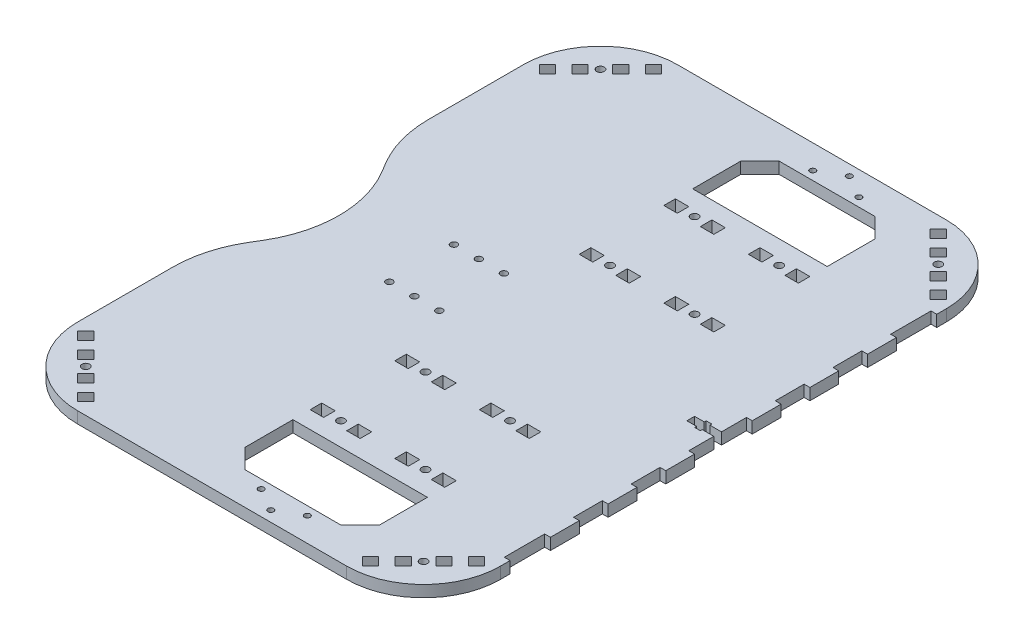
from build123d import *

# Parameters (mm, degrees)
ESQUISSE1_W                  = 220
ESQUISSE1_H                  = 312
BOSS_EXTRU_1_DEPTH           = 6
ESQUISSE2_R                  = 2
ESQUISSE2_W                  = 7
ESQUISSE2_H                  = 6
ENL_V_MAT_EXTRU_1_DEPTH      = 284.742811787
ESQUISSE3_W                  = 70
ESQUISSE3_H                  = 35
ENL_V_MAT_EXTRU_2_DEPTH      = 284.742811787
R_P_TITION_LIN_AIRE1_COUNT   = 2
R_P_TITION_LIN_AIRE1_PITCH   = 44
ESQUISSE4_R                  = 1.5
ENL_V_MAT_EXTRU_3_DEPTH      = 284.742811787
CHANFREIN1_SIZE              = 10
SYM_TRIE1_COPY_1_SKETCH_R    = 2
SYM_TRIE1_COPY_1_SKETCH_W    = 7
SYM_TRIE1_COPY_1_SKETCH_H    = 6
SYM_TRIE1_COPY_1_DEPTH       = 284.742811787
CHANFREIN1_OF_SYM_TRIE1_SIZE = 10
CONG_1_R                     = 40
ESQUISSE5_R                  = 1.75
ENL_V_MAT_EXTRU_4_DEPTH      = 284.742811787
ESQUISSE6_R                  = 2
ENL_V_MAT_EXTRU_5_DEPTH      = 6
SYM_TRIE3_COPY_1_SKETCH_R    = 2
SYM_TRIE3_COPY_1_DEPTH       = 6
ESQUISSE7_W                  = 3
ESQUISSE7_H                  = 15
ESQUISSE7_H_2                = 21
ENL_V_MAT_EXTRU_6_DEPTH      = 6
ENL_V_MAT_EXTRU_7_DEPTH      = 6
CONG_2_R                     = 60


with BuildPart() as part:
    # Esquisse1 → Boss.-Extru.1 (new body)
    with BuildSketch(Plane(origin=(0, 0, 0), x_dir=(1, 0, 0), z_dir=(0, 1, 0))):
        with Locations((39.245977219, 85.245977219)):
            Rectangle(ESQUISSE1_W, ESQUISSE1_H)
    extrude(amount=BOSS_EXTRU_1_DEPTH)

    # Esquisse2 → Enlèv. mat.-Extru.1 (cut, through all)
    with BuildSketch(Plane(origin=(0, 6, 0), x_dir=(1, 0, 0), z_dir=(0, 1, 0))):
        with Locations(Location((86.245977219, 177.245977219, 0), (0, 0, 270))):
            Circle(ESQUISSE2_R)
        with Locations(Location((42.245977219, 177.245977219, 0), (0, 0, 270))):
            Circle(ESQUISSE2_R)
        with Locations((95.745977219, 177.245977219)):
            Rectangle(ESQUISSE2_W, ESQUISSE2_H)
        with Locations((76.745977219, 177.245977219)):
            Rectangle(ESQUISSE2_W, ESQUISSE2_H)
        with Locations((51.745977219, 177.245977219)):
            Rectangle(ESQUISSE2_W, ESQUISSE2_H)
        with Locations((32.745977219, 177.245977219)):
            Rectangle(ESQUISSE2_W, ESQUISSE2_H)
    enl_v_mat_extru_1 = extrude(amount=-ENL_V_MAT_EXTRU_1_DEPTH, mode=Mode.SUBTRACT)

    # Esquisse3 → Enlèv. mat.-Extru.2 (cut, through all)
    with BuildSketch(Plane(origin=(0, 6, 0), x_dir=(1, 0, 0), z_dir=(0, 1, 0))):
        with Locations((64.245977219, 206.745977219)):
            Rectangle(ESQUISSE3_W, ESQUISSE3_H)
    enl_v_mat_extru_2 = extrude(amount=-ENL_V_MAT_EXTRU_2_DEPTH, mode=Mode.SUBTRACT)

    # Répétition linéaire1: Enlèv. mat.-Extru.1 ×2
    with Locations(*[(0, 0, i * R_P_TITION_LIN_AIRE1_PITCH) for i in range(1, R_P_TITION_LIN_AIRE1_COUNT)]):
        add(enl_v_mat_extru_1, mode=Mode.SUBTRACT)

    # Esquisse4 → Enlèv. mat.-Extru.3 (cut, through all)
    with BuildSketch(Plane(origin=(0, 6, 0), x_dir=(1, 0, 0), z_dir=(0, 1, 0))):
        with Locations(Location((52.245977219, 228.745977219, 0), (0, 0, 270))):
            Circle(ESQUISSE4_R)
        with Locations(Location((64.245977219, 235.745977219, 0), (0, 0, 270))):
            Circle(ESQUISSE4_R)
        with Locations(Location((76.245977219, 228.745977219, 0), (0, 0, 270))):
            Circle(ESQUISSE4_R)
    enl_v_mat_extru_3 = extrude(amount=-ENL_V_MAT_EXTRU_3_DEPTH, mode=Mode.SUBTRACT)

    # Chanfrein1
    chanfrein1_edges = [part.edges().sort_by_distance(p)[0] for p in [
        (99.245977219, 3, -224.245977219),
        (29.245977219, 3, -224.245977219),
    ]]
    chamfer(chanfrein1_edges, length=CHANFREIN1_SIZE)

    # Symétrie1: Enlèv. mat.-Extru.1, Enlèv. mat.-Extru.2, Enlèv. mat.-Extru.3 across plane
    add(enl_v_mat_extru_1.mirror(Plane.XY.offset(-85.245977219)), mode=Mode.SUBTRACT)
    add(enl_v_mat_extru_2.mirror(Plane.XY.offset(-85.245977219)), mode=Mode.SUBTRACT)
    add(enl_v_mat_extru_3.mirror(Plane.XY.offset(-85.245977219)), mode=Mode.SUBTRACT)

    # Symétrie1 copy 1 sketch → Symétrie1 copy 1 (cut, through all)
    with BuildSketch(Plane(origin=(0, 6, -214.491954438), x_dir=(1, 0, 0), z_dir=(0, 1, 0))):
        with Locations((86.245977219, -177.245977219)):
            Circle(SYM_TRIE1_COPY_1_SKETCH_R)
        with Locations((42.245977219, -177.245977219)):
            Circle(SYM_TRIE1_COPY_1_SKETCH_R)
        with Locations((95.745977219, -177.245977219)):
            Rectangle(SYM_TRIE1_COPY_1_SKETCH_W, SYM_TRIE1_COPY_1_SKETCH_H)
        with Locations((76.745977219, -177.245977219)):
            Rectangle(SYM_TRIE1_COPY_1_SKETCH_W, SYM_TRIE1_COPY_1_SKETCH_H)
        with Locations((51.745977219, -177.245977219)):
            Rectangle(SYM_TRIE1_COPY_1_SKETCH_W, SYM_TRIE1_COPY_1_SKETCH_H)
        with Locations((32.745977219, -177.245977219)):
            Rectangle(SYM_TRIE1_COPY_1_SKETCH_W, SYM_TRIE1_COPY_1_SKETCH_H)
    extrude(amount=-SYM_TRIE1_COPY_1_DEPTH, mode=Mode.SUBTRACT)

    # Chanfrein1 of Symétrie1
    chanfrein1_of_sym_trie1_edges = [part.edges().sort_by_distance(p)[0] for p in [
        (99.245977219, 3, 53.754022781),
        (29.245977219, 3, 53.754022781),
    ]]
    chamfer(chanfrein1_of_sym_trie1_edges, length=CHANFREIN1_OF_SYM_TRIE1_SIZE)

    # Congé1
    cong_1_edges = [part.edges().sort_by_distance(p)[0] for p in [
        (149.245977219, 3, 70.754022781),
        (-70.754022781, 3, 70.754022781),
        (-70.754022781, 3, -241.245977219),
        (149.245977219, 3, -241.245977219),
    ]]
    fillet(cong_1_edges, radius=CONG_1_R)

    # Esquisse5 → Enlèv. mat.-Extru.4 (cut, through all)
    with BuildSketch(Plane(origin=(0, 6, 0), x_dir=(1, 0, 0), z_dir=(0, 1, 0))):
        with Locations(Location((18.245977219, 102.045977219, 0), (0, 0, 270))):
            Circle(ESQUISSE5_R)
        with Locations(Location((5.245977219, 102.045977219, 0), (0, 0, 270))):
            Circle(ESQUISSE5_R)
        with Locations(Location((-7.754022781, 102.045977219, 0), (0, 0, 270))):
            Circle(ESQUISSE5_R)
        with Locations(Location((18.245977219, 68.445977219, 0), (0, 0, 270))):
            Circle(ESQUISSE5_R)
        with Locations(Location((5.245977219, 68.445977219, 0), (0, 0, 270))):
            Circle(ESQUISSE5_R)
        with Locations(Location((-7.754022781, 68.445977219, 0), (0, 0, 270))):
            Circle(ESQUISSE5_R)
    extrude(amount=-ENL_V_MAT_EXTRU_4_DEPTH, mode=Mode.SUBTRACT)

    # Esquisse6 → Enlèv. mat.-Extru.5 (cut)
    with BuildSketch(Plane(origin=(0, 6, 0), x_dir=(1, 0, 0), z_dir=(0, 1, 0))):
        with Locations(Location((-48.632702437, -48.632702437, 0), (0, 0, 270))):
            Circle(ESQUISSE6_R)
        Polygon((-53.936003296, -47.572042266), (-58.178643983, -43.329401578), (-53.936003296, -39.086760891), (-49.693362609, -43.329401578), align=None)
        Polygon((-62.42128467, -39.086760891), (-66.663925358, -34.844120204), (-62.42128467, -30.601479517), (-58.178643983, -34.844120204), align=None)
        Polygon((-47.572042266, -53.936003296), (-43.329401578, -58.178643983), (-39.086760891, -53.936003296), (-43.329401578, -49.693362609), align=None)
        Polygon((-39.086760891, -62.42128467), (-34.844120204, -66.663925358), (-30.601479517, -62.42128467), (-34.844120204, -58.178643983), align=None)
    enl_v_mat_extru_5 = extrude(amount=-ENL_V_MAT_EXTRU_5_DEPTH, mode=Mode.SUBTRACT)

    # Symétrie2: Enlèv. mat.-Extru.5 across plane
    add(enl_v_mat_extru_5.mirror(Plane.XY.offset(-85.245977219)), mode=Mode.SUBTRACT)

    # Symétrie3: Enlèv. mat.-Extru.5 across plane
    add(enl_v_mat_extru_5.mirror(Plane(origin=(39.245977219, 0, 0), x_dir=(0, 0, 1), z_dir=(1, 0, 0))), mode=Mode.SUBTRACT)

    # Symétrie3 copy 1 sketch → Symétrie3 copy 1 (cut)
    with BuildSketch(Plane(origin=(78.491954438, 6, -170.491954438), x_dir=(-1, 0, 0), z_dir=(0, 1, 0))):
        with Locations(Location((-48.632702437, -48.632702437, 0), (0, 0, 270))):
            Circle(SYM_TRIE3_COPY_1_SKETCH_R)
        Polygon((-53.936003296, -47.572042266), (-58.178643983, -43.329401578), (-53.936003296, -39.086760891), (-49.693362609, -43.329401578), align=None)
        Polygon((-62.42128467, -39.086760891), (-66.663925358, -34.844120204), (-62.42128467, -30.601479517), (-58.178643983, -34.844120204), align=None)
        Polygon((-47.572042266, -53.936003296), (-43.329401578, -58.178643983), (-39.086760891, -53.936003296), (-43.329401578, -49.693362609), align=None)
        Polygon((-39.086760891, -62.42128467), (-34.844120204, -66.663925358), (-30.601479517, -62.42128467), (-34.844120204, -58.178643983), align=None)
    extrude(amount=-SYM_TRIE3_COPY_1_DEPTH, mode=Mode.SUBTRACT)

    # Esquisse7 → Enlèv. mat.-Extru.6 (cut)
    with BuildSketch(Plane(origin=(0, 6, 0), x_dir=(1, 0, 0), z_dir=(0, 1, 0))):
        Polygon((137.245977219, 87.245977219), (137.245977219, 88.245977219), (140.245977219, 88.245977219), (140.245977219, 87.245977219), (146.245977219, 87.245977219), (146.245977219, 100.245977219), (149.245977219, 100.245977219), (149.245977219, 70.245977219), (146.245977219, 70.245977219), (146.245977219, 83.245977219), (140.245977219, 83.245977219), (140.245977219, 82.245977219), (137.245977219, 82.245977219), (137.245977219, 83.245977219), (132.245977219, 83.245977219), (132.245977219, 87.245977219), align=None)
        with Locations((147.745977219, 122.745977219)):
            Rectangle(ESQUISSE7_W, ESQUISSE7_H)
        with Locations((147.745977219, 152.745977219)):
            Rectangle(ESQUISSE7_W, ESQUISSE7_H)
        with Locations((147.745977219, 185.745977219)):
            Rectangle(ESQUISSE7_W, ESQUISSE7_H_2)
        with Locations((147.745977219, 47.745977219)):
            Rectangle(ESQUISSE7_W, ESQUISSE7_H)
        with Locations((147.745977219, 17.745977219)):
            Rectangle(ESQUISSE7_W, ESQUISSE7_H)
        with Locations((147.745977219, -15.254022781)):
            Rectangle(ESQUISSE7_W, ESQUISSE7_H_2)
    extrude(amount=-ENL_V_MAT_EXTRU_6_DEPTH, mode=Mode.SUBTRACT)

    # Esquisse8 → Enlèv. mat.-Extru.7 (cut)
    with BuildSketch(Plane(origin=(0, 6, 0), x_dir=(1, 0, 0), z_dir=(0, 1, 0))):
        Polygon((-70.754022781, 135.245977219), (-40.754022781, 85.245977219), (-70.754022781, 35.245977219), align=None)
    extrude(amount=-ENL_V_MAT_EXTRU_7_DEPTH, mode=Mode.SUBTRACT)

    # Congé2
    cong_2_edges = [part.edges().sort_by_distance(p)[0] for p in [
        (-70.754022781, 3, -35.245977219),
        (-70.754022781, 3, -135.245977219),
        (-40.754022781, 3, -85.245977219),
    ]]
    fillet(cong_2_edges, radius=CONG_2_R)


solid = part.part
